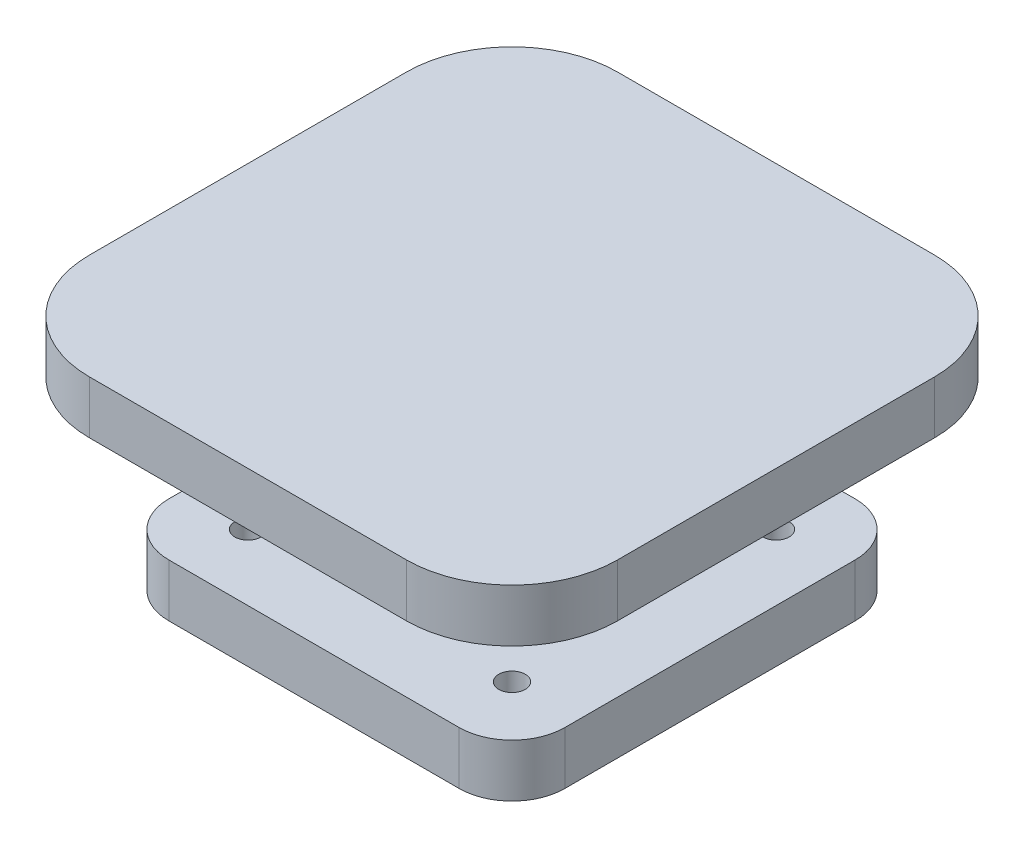
from build123d import *

# Parameters (mm, degrees)
SKETCH_1_W      = 150
SKETCH_1_H      = 150
SKETCH_1_R      = 5
EXTRUDE_1_DEPTH = 20
FILLET_1_R      = 20
SKETCH_2_R      = 50
EXTRUDE_2_DEPTH = 50
SKETCH_3_W      = 200
SKETCH_3_H      = 200
EXTRUDE_3_DEPTH = 20
FILLET_2_R      = 40


with BuildPart() as part:
    # Эскиз1 → Бобышка-Вытянуть1 (new body)
    with BuildSketch(Plane(origin=(0, 0, 0), x_dir=(1, 0, 0), z_dir=(0, 1, 0))):
        Rectangle(SKETCH_1_W, SKETCH_1_H)
        with Locations(Location((-50, 50, 0), (0, 0, 270))):
            Circle(SKETCH_1_R, mode=Mode.SUBTRACT)
        with Locations(Location((50, 50, 0), (0, 0, 270))):
            Circle(SKETCH_1_R, mode=Mode.SUBTRACT)
        with Locations(Location((50, -50, 0), (0, 0, 270))):
            Circle(SKETCH_1_R, mode=Mode.SUBTRACT)
        with Locations(Location((-50, -50, 0), (0, 0, 270))):
            Circle(SKETCH_1_R, mode=Mode.SUBTRACT)
    extrude(amount=EXTRUDE_1_DEPTH)

    # Скругление1
    fillet_1_edges = [part.edges().sort_by_distance(p)[0] for p in [
        (-75, 10, 75),
        (-75, 10, -75),
        (75, 10, -75),
        (75, 10, 75),
    ]]
    fillet(fillet_1_edges, radius=FILLET_1_R)

    # Эскиз2 → Бобышка-Вытянуть2 (add)
    with BuildSketch(Plane(origin=(0, 20, 0), x_dir=(1, 0, 0), z_dir=(0, 1, 0))):
        with Locations(Location((0, 0, 0), (0, 0, 270))):
            Circle(SKETCH_2_R)
    extrude(amount=EXTRUDE_2_DEPTH)

    # Эскиз3 → Бобышка-Вытянуть3 (add)
    with BuildSketch(Plane(origin=(0, 70, 0), x_dir=(1, 0, 0), z_dir=(0, 1, 0))):
        Rectangle(SKETCH_3_W, SKETCH_3_H)
    extrude(amount=EXTRUDE_3_DEPTH)

    # Скругление2
    fillet_2_edges = [part.edges().sort_by_distance(p)[0] for p in [
        (100, 80, 100),
        (100, 80, -100),
        (-100, 80, -100),
        (-100, 80, 100),
    ]]
    fillet(fillet_2_edges, radius=FILLET_2_R)


solid = part.part
